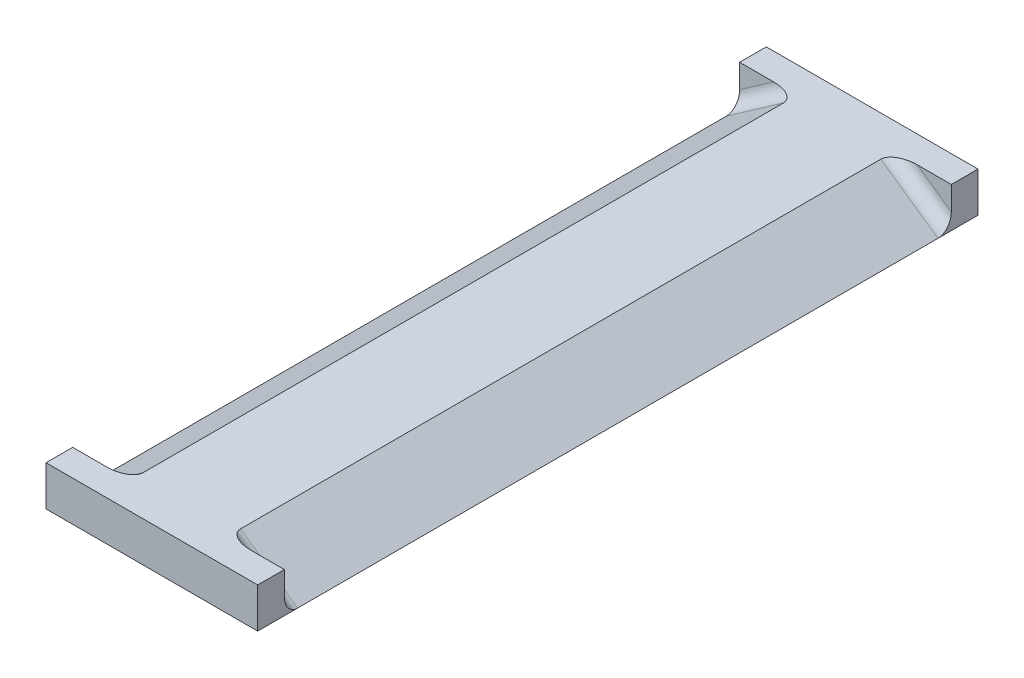
from build123d import *

# Parameters (mm, degrees)
BOSS_EXTRUDE1_DEPTH = 25
SKETCH2_W           = 7.93444402
SKETCH2_H           = 1.5
BOSS_EXTRUDE2_DEPTH = 1
SKETCH3_W           = 7.93444402
SKETCH3_H           = 1.5
BOSS_EXTRUDE3_DEPTH = 1
FILLET1_R           = 0.5


with BuildPart() as part:
    # Sketch1 → Boss-Extrude1 (new body)
    with BuildSketch(Plane.XY):
        Polygon((0, 0), (-2.14222201, -1.5), (5.79222201, -1.5), (3.65, 0), align=None)
    extrude(amount=BOSS_EXTRUDE1_DEPTH)

    # Sketch2 → Boss-Extrude2 (add)
    with BuildSketch(Plane.XY.offset(25)):
        with Locations((1.825, -0.75)):
            Rectangle(SKETCH2_W, SKETCH2_H)
    extrude(amount=BOSS_EXTRUDE2_DEPTH)

    # Sketch3 → Boss-Extrude3 (add)
    with BuildSketch(Plane(origin=(0, 0, 0), x_dir=(-1, 0, 0), z_dir=(0, 0, -1))):
        with Locations((-1.825, -0.75)):
            Rectangle(SKETCH3_W, SKETCH3_H)
    extrude(amount=BOSS_EXTRUDE3_DEPTH)

    # Fillet1
    fillet1_edges = [part.edges().sort_by_distance(p)[0] for p in [
        (4.721111005, -0.75, 25),
        (4.721111005, -0.75, 0),
        (-1.071111005, -0.75, 0),
        (-1.071111005, -0.75, 25),
    ]]
    fillet(fillet1_edges, radius=FILLET1_R)


solid = part.part
